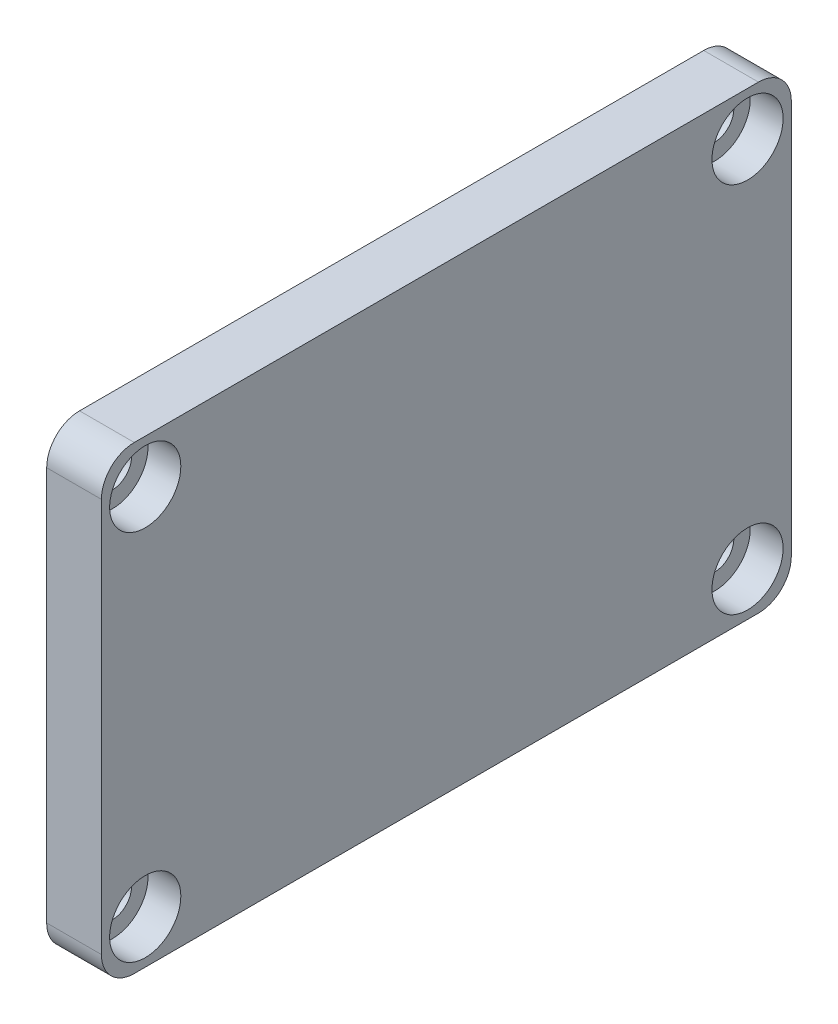
from build123d import *

# Parameters (mm, degrees)
BOSS_EXTRUDE1_DEPTH = 5
SKETCH2_R           = 1.75
CUT_EXTRUDE1_DEPTH  = 39.187039686
SKETCH3_R           = 3.25
CUT_EXTRUDE2_DEPTH  = 3


with BuildPart() as part:
    # Sketch1 → Boss-Extrude1 (new body)
    with BuildSketch(Plane.YZ):
        with BuildLine():
            Line((-18, -31.5), (18, -31.5))
            ThreePointArc((18, -31.5), (20.121320344, -30.621320344), (21, -28.5))
            Line((21, -28.5), (21, 28.5))
            ThreePointArc((21, 28.5), (20.121320344, 30.621320344), (18, 31.5))
            Line((18, 31.5), (-18, 31.5))
            ThreePointArc((-18, 31.5), (-20.121320344, 30.621320344), (-21, 28.5))
            Line((-21, 28.5), (-21, -28.5))
            ThreePointArc((-21, -28.5), (-20.121320344, -30.621320344), (-18, -31.5))
        make_face()
    extrude(amount=BOSS_EXTRUDE1_DEPTH)

    # Sketch2 → Cut-Extrude1 (cut, through all)
    with BuildSketch(Plane.YZ.offset(5)):
        with Locations(Location((-17, 27.5, 0), (0, 0, 270))):
            Circle(SKETCH2_R)
        with Locations(Location((17, 27.5, 0), (0, 0, 270))):
            Circle(SKETCH2_R)
        with Locations(Location((17, -27.5, 0), (0, 0, 270))):
            Circle(SKETCH2_R)
        with Locations(Location((-17, -27.5, 0), (0, 0, 270))):
            Circle(SKETCH2_R)
    extrude(amount=-CUT_EXTRUDE1_DEPTH, mode=Mode.SUBTRACT)

    # Sketch3 → Cut-Extrude2 (cut)
    with BuildSketch(Plane.YZ.offset(5)):
        with Locations(Location((17, 27.5, 0), (0, 0, 270))):
            Circle(SKETCH3_R)
        with Locations(Location((-17, 27.5, 0), (0, 0, 270))):
            Circle(SKETCH3_R)
        with Locations(Location((17, -27.5, 0), (0, 0, 270))):
            Circle(SKETCH3_R)
        with Locations(Location((-17, -27.5, 0), (0, 0, 270))):
            Circle(SKETCH3_R)
    extrude(amount=-CUT_EXTRUDE2_DEPTH, mode=Mode.SUBTRACT)


solid = part.part
